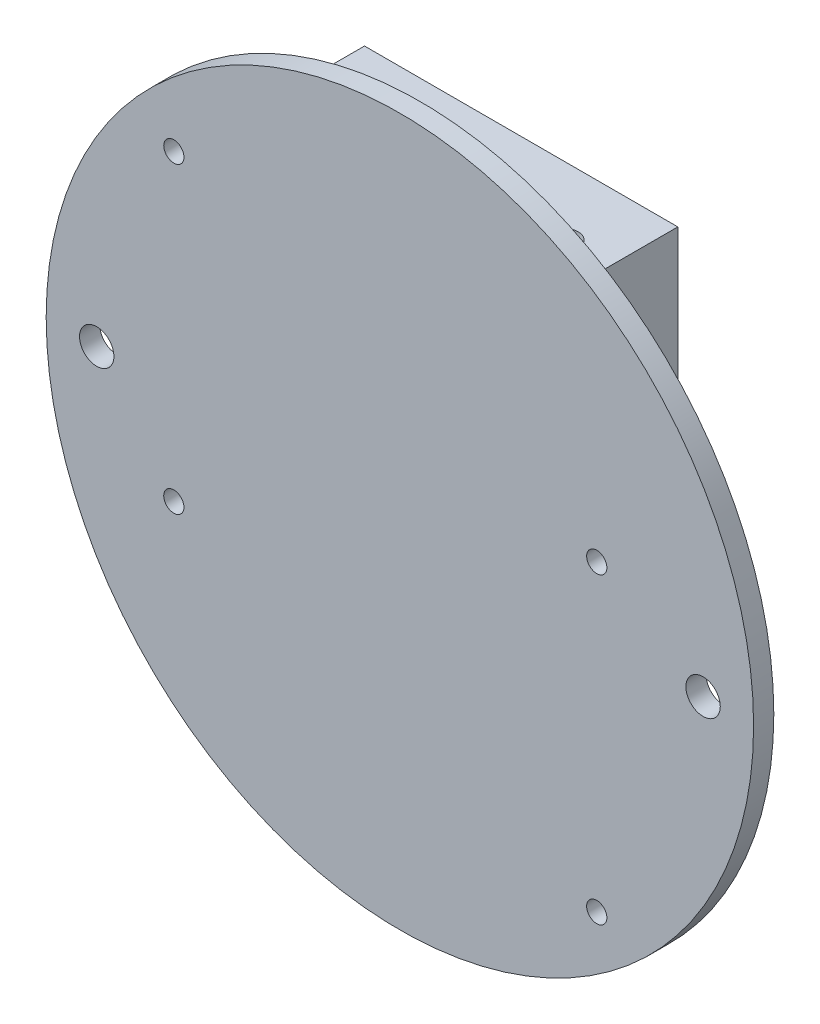
from build123d import *

# Parameters (mm, degrees)
SKETCH1_R                      = 35
BOSS_EXTRUDE1_DEPTH            = 2
SKETCH2_W                      = 31
SKETCH2_H                      = 36.5
SKETCH2_W_2                    = 29
SKETCH2_H_2                    = 34.5
BOSS_EXTRUDE2_DEPTH            = 10
SKETCH3_R                      = 1
CUT_EXTRUDE1_DEPTH             = 10
CUT_EXTRUDE2_REACH             = 58.721
SKETCH5_R                      = 1.4
CUT_EXTRUDE2_DIRECTION_2_REACH = 58.721
SKETCH6_R                      = 1.7
CUT_EXTRUDE3_DEPTH             = 51.931326313


with BuildPart() as part:
    # Sketch1 → Boss-Extrude1 (new body)
    with BuildSketch(Plane.XY):
        Circle(SKETCH1_R)
    extrude(amount=BOSS_EXTRUDE1_DEPTH)

    # Sketch2 → Boss-Extrude2 (add)
    with BuildSketch(Plane(origin=(0, 0, 0), x_dir=(-1, 0, 0), z_dir=(0, 0, -1))):
        with Locations((0, 8.75)):
            Rectangle(SKETCH2_W, SKETCH2_H)
        with Locations((0, 8.75)):
            Rectangle(SKETCH2_W_2, SKETCH2_H_2, mode=Mode.SUBTRACT)
    extrude(amount=BOSS_EXTRUDE2_DEPTH)

    # Sketch3 → Cut-Extrude1 (cut)
    with BuildSketch(Plane(origin=(0, 0, 0), x_dir=(-1, 0, 0), z_dir=(0, 0, -1))):
        with Locations((22.366777203, 20.53)):
            Circle(SKETCH3_R)
        with Locations((22.37, -9.469999827)):
            Circle(SKETCH3_R)
        with Locations((-19.48, 6.28)):
            Circle(SKETCH3_R)
        with Locations((-19.48, -23.72)):
            Circle(SKETCH3_R)
    extrude(amount=-CUT_EXTRUDE1_DEPTH, mode=Mode.SUBTRACT)

    # Cut-Extrude2: up to this face of the body (flat: up to its plane)
    cut_extrude2_end = Plane(part.part.faces().sort_by_distance((0, -9.5, -5))[0])
    # Sketch5 → Cut-Extrude2 (cut, up to the picked face)
    with BuildSketch(Plane(origin=(0, -8.5, 0), x_dir=(1, 0, 0), z_dir=(0, 1, 0)), mode=Mode.PRIVATE) as cut_extrude2_sk1:
        with Locations((-11, 3.25)):
            Circle(SKETCH5_R)
    cut_extrude2_tool1 = split(extrude(cut_extrude2_sk1.sketch, amount=-CUT_EXTRUDE2_REACH, mode=Mode.PRIVATE), bisect_by=cut_extrude2_end, keep=Keep.BOTH, mode=Mode.PRIVATE)
    # Sketch5 → Cut-Extrude2 (cut, up to the picked face)
    with BuildSketch(Plane(origin=(0, -8.5, 0), x_dir=(1, 0, 0), z_dir=(0, 1, 0)), mode=Mode.PRIVATE) as cut_extrude2_sk2:
        with Locations((11, 3.25)):
            Circle(SKETCH5_R)
    cut_extrude2_tool2 = split(extrude(cut_extrude2_sk2.sketch, amount=-CUT_EXTRUDE2_REACH, mode=Mode.PRIVATE), bisect_by=cut_extrude2_end, keep=Keep.BOTH, mode=Mode.PRIVATE)
    add(cut_extrude2_tool1.solids().sort_by(Axis((-11, -8.5, -3.25), (0, -1, 0)))[0], mode=Mode.SUBTRACT)
    add(cut_extrude2_tool2.solids().sort_by(Axis((11, -8.5, -3.25), (0, -1, 0)))[0], mode=Mode.SUBTRACT)

    # Cut-Extrude2 direction 2: up to this face of the body (flat: up to its plane)
    cut_extrude2_direction_2_end = Plane(part.part.faces().sort_by_distance((0, 27, -5))[0])
    # Sketch5 → Cut-Extrude2 direction 2 (cut, up to the picked face)
    with BuildSketch(Plane(origin=(0, -8.5, 0), x_dir=(1, 0, 0), z_dir=(0, 1, 0)), mode=Mode.PRIVATE) as cut_extrude2_direction_2_sk1:
        with Locations((-11, 3.25)):
            Circle(SKETCH5_R)
    cut_extrude2_direction_2_tool1 = split(extrude(cut_extrude2_direction_2_sk1.sketch, amount=CUT_EXTRUDE2_DIRECTION_2_REACH, mode=Mode.PRIVATE), bisect_by=cut_extrude2_direction_2_end, keep=Keep.BOTH, mode=Mode.PRIVATE)
    # Sketch5 → Cut-Extrude2 direction 2 (cut, up to the picked face)
    with BuildSketch(Plane(origin=(0, -8.5, 0), x_dir=(1, 0, 0), z_dir=(0, 1, 0)), mode=Mode.PRIVATE) as cut_extrude2_direction_2_sk2:
        with Locations((11, 3.25)):
            Circle(SKETCH5_R)
    cut_extrude2_direction_2_tool2 = split(extrude(cut_extrude2_direction_2_sk2.sketch, amount=CUT_EXTRUDE2_DIRECTION_2_REACH, mode=Mode.PRIVATE), bisect_by=cut_extrude2_direction_2_end, keep=Keep.BOTH, mode=Mode.PRIVATE)
    add(cut_extrude2_direction_2_tool1.solids().sort_by(Axis((-11, -8.5, -3.25), (0, 1, 0)))[0], mode=Mode.SUBTRACT)
    add(cut_extrude2_direction_2_tool2.solids().sort_by(Axis((11, -8.5, -3.25), (0, 1, 0)))[0], mode=Mode.SUBTRACT)

    # Sketch6 → Cut-Extrude3 (cut, through all)
    with BuildSketch(Plane.XY.offset(2)):
        with Locations((30, 0)):
            Circle(SKETCH6_R)
        with Locations((-30, 0)):
            Circle(SKETCH6_R)
    extrude(amount=-CUT_EXTRUDE3_DEPTH, mode=Mode.SUBTRACT)


solid = part.part
